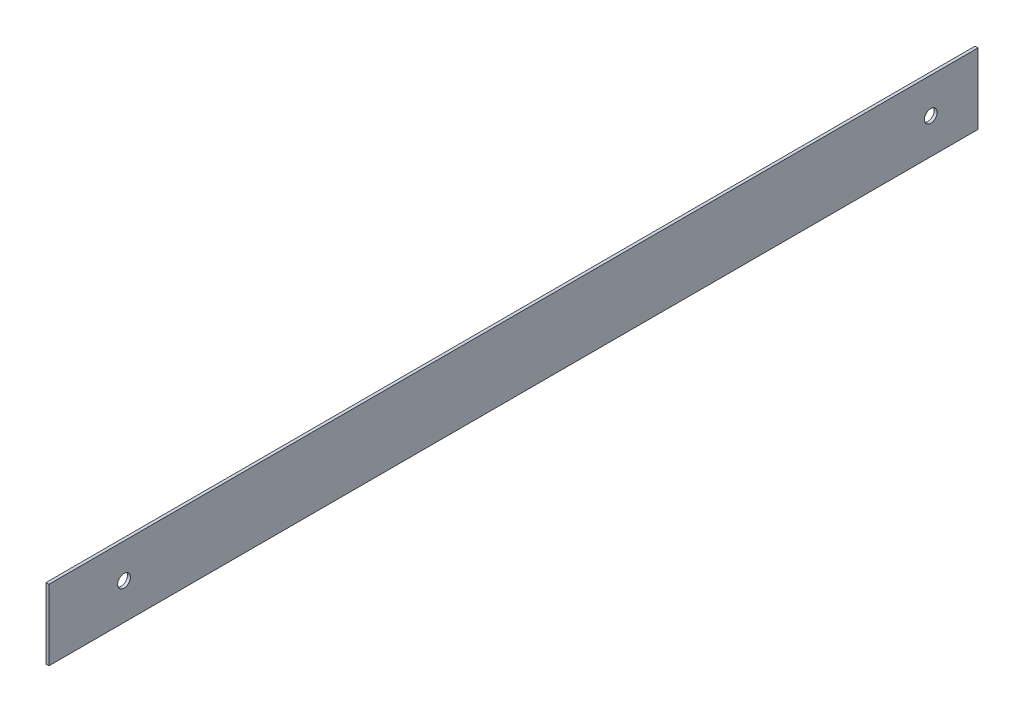
from build123d import *

# Parameters (mm, degrees)
SKETCH1_W           = 999.999999996
SKETCH1_H           = 76.073
BOSS_EXTRUDE1_DEPTH = 3.175


with BuildPart() as part:
    # Sketch1 → Boss-Extrude1 (new body)
    with BuildSketch(Plane(origin=(0, 0, 0), x_dir=(0, 0, -1), z_dir=(1, 0, 0))):
        with Locations((499.999999998, -38.0365)):
            Rectangle(SKETCH1_W, SKETCH1_H)
    extrude(amount=BOSS_EXTRUDE1_DEPTH)

    # Sketch13 → 1/4 NPT Tapped Hole3 (revolve, cut)
    with BuildSketch(Plane(origin=(3.175, -37.187581484, -80.83584166), x_dir=(0, 0, -1), z_dir=(0, 1, 0))):
        Polygon((0, 0), (0, 3.175), (5.5626, 3.175), (5.5626, 9.906), (6.557984794, 9.906), (6.8545837, 0), align=None)
    revolve(axis=Axis((9.525, -37.187581484, -80.83584166), (-1, 0, 0)), mode=Mode.SUBTRACT)

    # Sketch15 → 1/4 NPT Tapped Hole4 (revolve, cut)
    with BuildSketch(Plane(origin=(3.175, -38.0365, -949.199999996), x_dir=(0, 0, -1), z_dir=(0, 1, 0))):
        Polygon((0, 0), (0, 3.175), (5.5626, 3.175), (5.5626, 9.906), (6.557984794, 9.906), (6.8545837, 0), align=None)
    revolve(axis=Axis((9.525, -38.0365, -949.199999996), (-1, 0, 0)), mode=Mode.SUBTRACT)


solid = part.part
